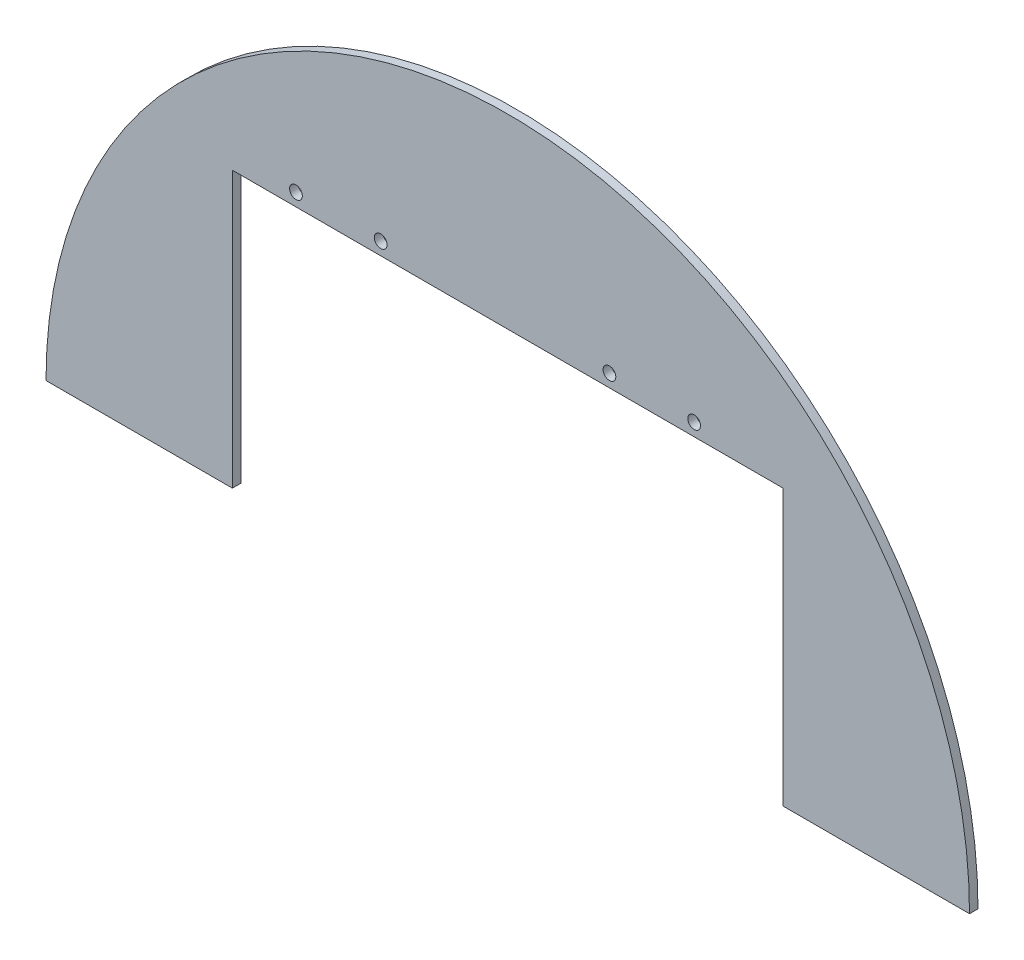
from build123d import *

# Parameters (mm, degrees)
EXTRUDE_1_DEPTH     = 1
SKETCH_2_R          = 1.5
CUT_EXTRUDE_1_DEPTH = 10


with BuildPart() as part:
    # 草图1 → 凸台-拉伸1 (new, symmetric)
    with BuildSketch(Plane.XY):
        with BuildLine():
            ThreePointArc((109, 0), (0, 109), (-109, 0))
            Line((-109, 0), (-65, 0))
            Line((-65, 0), (-65, 65))
            Line((-65, 65), (65, 65))
            Line((65, 65), (65, 0))
            Line((65, 0), (109, 0))
        make_face()
    extrude(amount=EXTRUDE_1_DEPTH, both=True)

    # 草图2 → 切除-拉伸1 (cut)
    with BuildSketch(Plane.XY.offset(1)):
        with Locations((44, 68)):
            Circle(SKETCH_2_R)
        with Locations((24, 68)):
            Circle(SKETCH_2_R)
        with Locations((-30, 68)):
            Circle(SKETCH_2_R)
        with Locations((-50, 68)):
            Circle(SKETCH_2_R)
    extrude(amount=-CUT_EXTRUDE_1_DEPTH, mode=Mode.SUBTRACT)


solid = part.part
